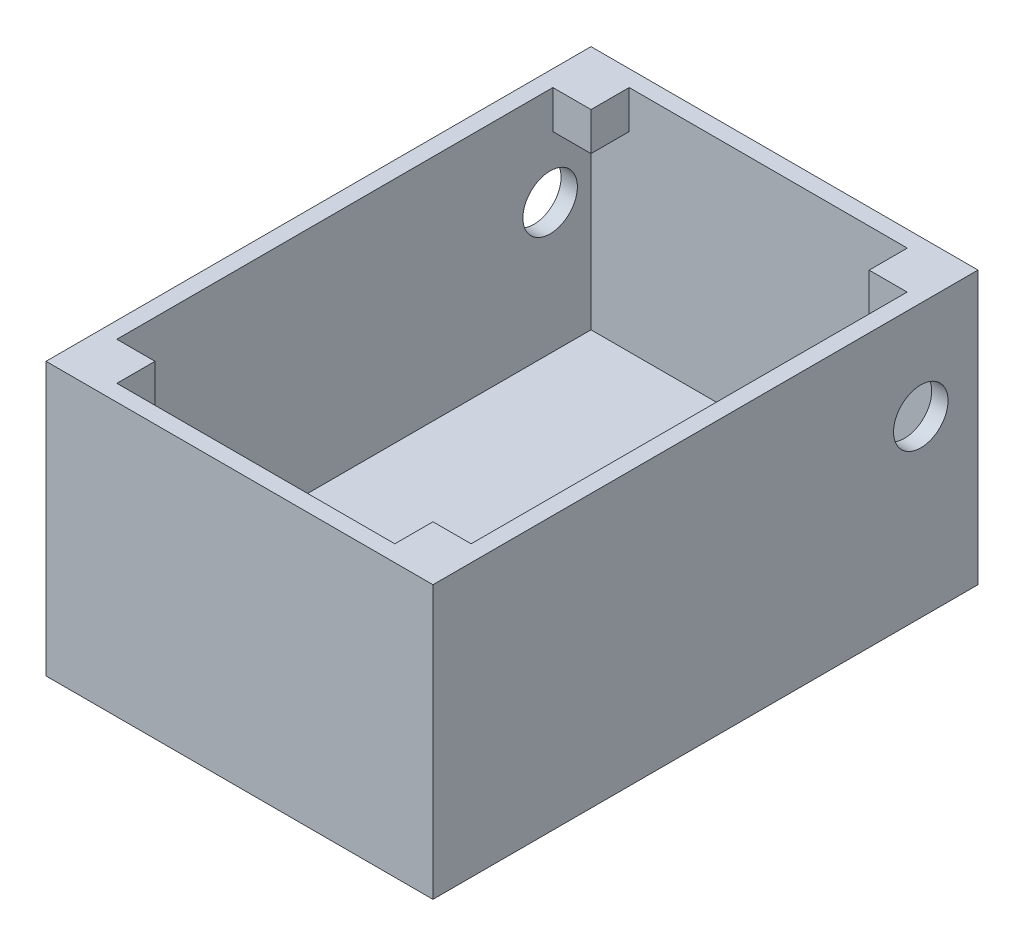
from build123d import *

# Parameters (mm, degrees)
SKETCH1_W               = 71
SKETCH1_H               = 100
BOSS_EXTRUDE1_DEPTH     = 50
SKETCH2_W               = 65
SKETCH2_H               = 94
CUT_EXTRUDE1_DEPTH      = 47
SKETCH3_W               = 51
SKETCH3_H               = 61.662084765
BOSS_EXTRUDE2_DEPTH     = 5
CUT_EXTRUDE2_DEPTH      = 110.973860531
CUT_EXTRUDE2_DEPTH_BACK = 110.973860531
SKETCH4_R               = 5
SKETCH5_W               = 10
SKETCH5_H               = 10
SKETCH5_W_2             = 9.971264926
BOSS_EXTRUDE3_DEPTH     = 7


with BuildPart() as part:
    # Sketch1 → Boss-Extrude1 (new body)
    with BuildSketch(Plane(origin=(0, 0, 0), x_dir=(1, 0, 0), z_dir=(0, 1, 0))):
        with Locations((-29.196168954, -20.5)):
            Rectangle(SKETCH1_W, SKETCH1_H)
    extrude(amount=BOSS_EXTRUDE1_DEPTH)

    # Sketch2 → Cut-Extrude1 (cut)
    with BuildSketch(Plane(origin=(0, 50, 0), x_dir=(1, 0, 0), z_dir=(0, 1, 0))):
        with Locations((-29.196168954, -20.5)):
            Rectangle(SKETCH2_W, SKETCH2_H)
    extrude(amount=-CUT_EXTRUDE1_DEPTH, mode=Mode.SUBTRACT)

    # Sketch3 → Boss-Extrude2 (add)
    with BuildSketch(Plane(origin=(0, 3, 0), x_dir=(1, 0, 0), z_dir=(0, 1, 0))):
        with Locations((-36.196168954, -4.331042383)):
            Rectangle(SKETCH3_W, SKETCH3_H)
    extrude(amount=BOSS_EXTRUDE2_DEPTH)

    # Sketch4 → Cut-Extrude2 (cut, two sides: drawn at the far end of the back side and taken through both)
    with BuildSketch(Plane(origin=(-61.696168954, 0, 0), x_dir=(0, 0, -1), z_dir=(1, 0, 0)).offset(-CUT_EXTRUDE2_DEPTH_BACK)):
        with Locations((19, 32)):
            Circle(SKETCH4_R)
    extrude(amount=CUT_EXTRUDE2_DEPTH + CUT_EXTRUDE2_DEPTH_BACK, mode=Mode.SUBTRACT)

    # Sketch5 → Boss-Extrude3 (add)
    with BuildSketch(Plane(origin=(0, 50, 0), x_dir=(1, 0, 0), z_dir=(0, 1, 0))):
        with Locations((-59.696168954, 24.5)):
            Rectangle(SKETCH5_W, SKETCH5_H)
        with Locations((1.318198583, 24.5)):
            Rectangle(SKETCH5_W_2, SKETCH5_H)
        with Locations((1.303831046, -65.5)):
            Rectangle(SKETCH5_W, SKETCH5_H)
        with Locations((-59.696168954, -65.5)):
            Rectangle(SKETCH5_W, SKETCH5_H)
    extrude(amount=-BOSS_EXTRUDE3_DEPTH)


solid = part.part
